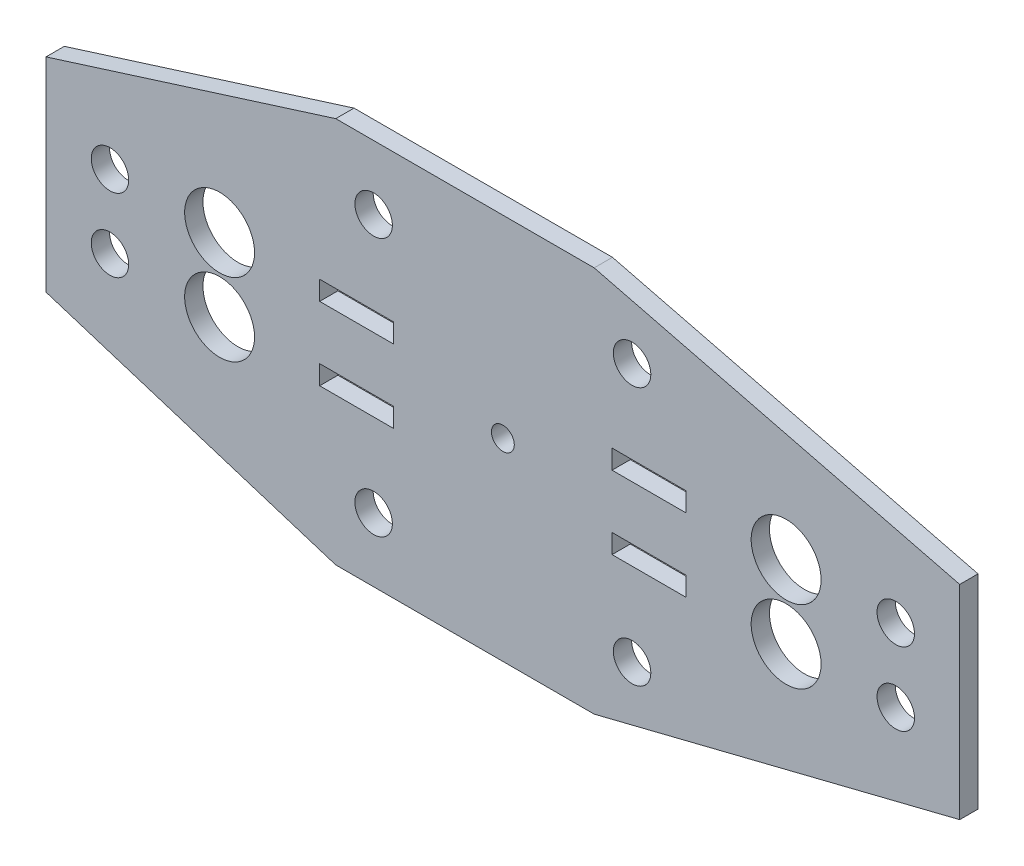
from build123d import *

# Parameters (mm, degrees)
SKETCH_1_R      = 3.825
SKETCH_1_R_2    = 2.05
SKETCH_1_R_3    = 1.25
SKETCH_1_W      = 8.1
SKETCH_1_H      = 2.1
EXTRUDE_1_DEPTH = 2


with BuildPart() as part:
    # 草图1 → 凸台-拉伸1 (new body)
    with BuildSketch(Plane.XY):
        Polygon((81, -15.149736791), (81, 7.149736791), (40.992999038, 17.149736791), (12.70872779, 17.149736791), (-19, 7.149736791), (-19, -15.149736791), (12.70872779, -25.149736791), (40.992999038, -25.149736791), align=None)
        Circle(SKETCH_1_R, mode=Mode.SUBTRACT)
        with Locations((62, 0)):
            Circle(SKETCH_1_R, mode=Mode.SUBTRACT)
        with Locations((62, -8)):
            Circle(SKETCH_1_R, mode=Mode.SUBTRACT)
        with Locations((0, -8)):
            Circle(SKETCH_1_R, mode=Mode.SUBTRACT)
        with Locations((45.142135624, 10.142135624)):
            Circle(SKETCH_1_R_2, mode=Mode.SUBTRACT)
        with Locations((45.142135624, -18.142135624)):
            Circle(SKETCH_1_R_2, mode=Mode.SUBTRACT)
        with Locations((16.857864376, -18.142135624)):
            Circle(SKETCH_1_R_2, mode=Mode.SUBTRACT)
        with Locations((16.857864376, 10.142135624)):
            Circle(SKETCH_1_R_2, mode=Mode.SUBTRACT)
        with Locations((74, 0)):
            Circle(SKETCH_1_R_2, mode=Mode.SUBTRACT)
        with Locations((74, -8)):
            Circle(SKETCH_1_R_2, mode=Mode.SUBTRACT)
        with Locations((-12, -8)):
            Circle(SKETCH_1_R_2, mode=Mode.SUBTRACT)
        with Locations((-12, 0)):
            Circle(SKETCH_1_R_2, mode=Mode.SUBTRACT)
        with Locations((31, -4)):
            Circle(SKETCH_1_R_3, mode=Mode.SUBTRACT)
        with Locations((15, 0)):
            Rectangle(SKETCH_1_W, SKETCH_1_H, mode=Mode.SUBTRACT)
        with Locations((47, 0)):
            Rectangle(SKETCH_1_W, SKETCH_1_H, mode=Mode.SUBTRACT)
        with Locations((47, -8)):
            Rectangle(SKETCH_1_W, SKETCH_1_H, mode=Mode.SUBTRACT)
        with Locations((15, -8)):
            Rectangle(SKETCH_1_W, SKETCH_1_H, mode=Mode.SUBTRACT)
    extrude(amount=EXTRUDE_1_DEPTH)


solid = part.part
